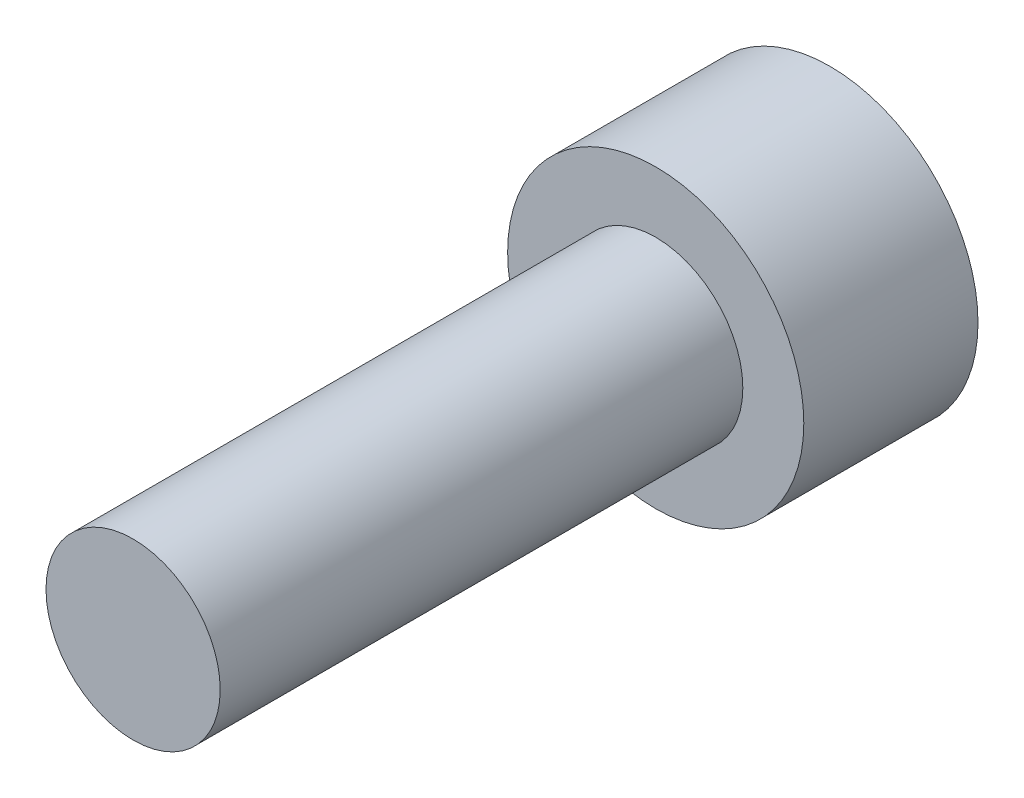
from build123d import *

# Parameters (mm, degrees)
SKETCH_1_R          = 4.25
EXTRUDE_1_DEPTH     = 5
SKETCH_2_R          = 2.5
EXTRUDE_2_DEPTH     = 15
CUT_EXTRUDE_1_DEPTH = 2


with BuildPart() as part:
    # ｽｹｯﾁ1 → ﾎﾞｽ - 押し出し1 (new body)
    with BuildSketch(Plane.XY):
        Circle(SKETCH_1_R)
    extrude(amount=EXTRUDE_1_DEPTH)

    # ｽｹｯﾁ2 → ﾎﾞｽ - 押し出し2 (add)
    with BuildSketch(Plane.XY.offset(5)):
        Circle(SKETCH_2_R)
    extrude(amount=EXTRUDE_2_DEPTH)

    # ｽｹｯﾁ3 → ｶｯﾄ - 押し出し1 (cut)
    with BuildSketch(Plane(origin=(0, 0, 0), x_dir=(-1, 0, 0), z_dir=(0, 0, -1))):
        Polygon((2.481247226, -1.110941893), (2.202727514, 1.593352185), (-0.278519712, 2.704294077), (-2.481247226, 1.110941893), (-2.202727514, -1.593352185), (0.278519712, -2.704294077), align=None)
    extrude(amount=-CUT_EXTRUDE_1_DEPTH, mode=Mode.SUBTRACT)


solid = part.part
